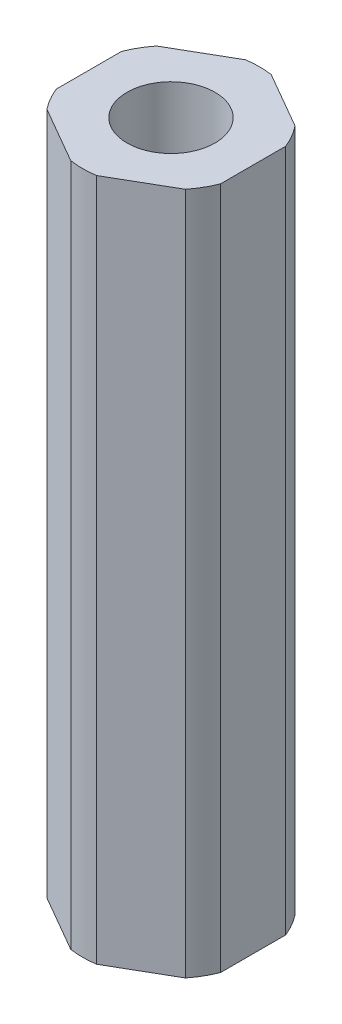
from build123d import *

# Parameters (mm, degrees)
BOSS_EXTRUDE1_DEPTH = 39.624
SKETCH2_R           = 2.5527
CUT_EXTRUDE1_DEPTH  = 41.236833499


with BuildPart() as part:
    # Sketch1 → Boss-Extrude1 (new body)
    with BuildSketch(Plane(origin=(0, 0, 0), x_dir=(1, 0, 0), z_dir=(0, 1, 0))):
        with BuildLine():
            Line((-0.742977689, 5.070302945), (-4.019522311, 3.178589026))
            ThreePointArc((-4.019522311, 3.178589026), (-4.43790388, 2.562225), (-4.7625, 1.891713919))
            Line((-4.7625, 1.891713919), (-4.7625, -1.891713919))
            ThreePointArc((-4.7625, -1.891713919), (-4.43790388, -2.562225), (-4.019522311, -3.178589026))
            Line((-4.019522311, -3.178589026), (-0.742977689, -5.070302945))
            ThreePointArc((-0.742977689, -5.070302945), (0, -5.12445), (0.742977689, -5.070302945))
            Line((0.742977689, -5.070302945), (4.019522311, -3.178589026))
            ThreePointArc((4.019522311, -3.178589026), (4.43790388, -2.562225), (4.7625, -1.891713919))
            Line((4.7625, -1.891713919), (4.7625, 1.891713919))
            ThreePointArc((4.7625, 1.891713919), (4.43790388, 2.562225), (4.019522311, 3.178589026))
            Line((4.019522311, 3.178589026), (0.742977689, 5.070302945))
            ThreePointArc((0.742977689, 5.070302945), (0, 5.12445), (-0.742977689, 5.070302945))
        make_face()
    extrude(amount=BOSS_EXTRUDE1_DEPTH)

    # Sketch2 → Cut-Extrude1 (cut, through all)
    with BuildSketch(Plane(origin=(0, 39.624, 0), x_dir=(1, 0, 0), z_dir=(0, 1, 0))):
        with Locations(Location((0, 0, 0), (0, 0, 270))):
            Circle(SKETCH2_R)
    extrude(amount=-CUT_EXTRUDE1_DEPTH, mode=Mode.SUBTRACT)


solid = part.part
